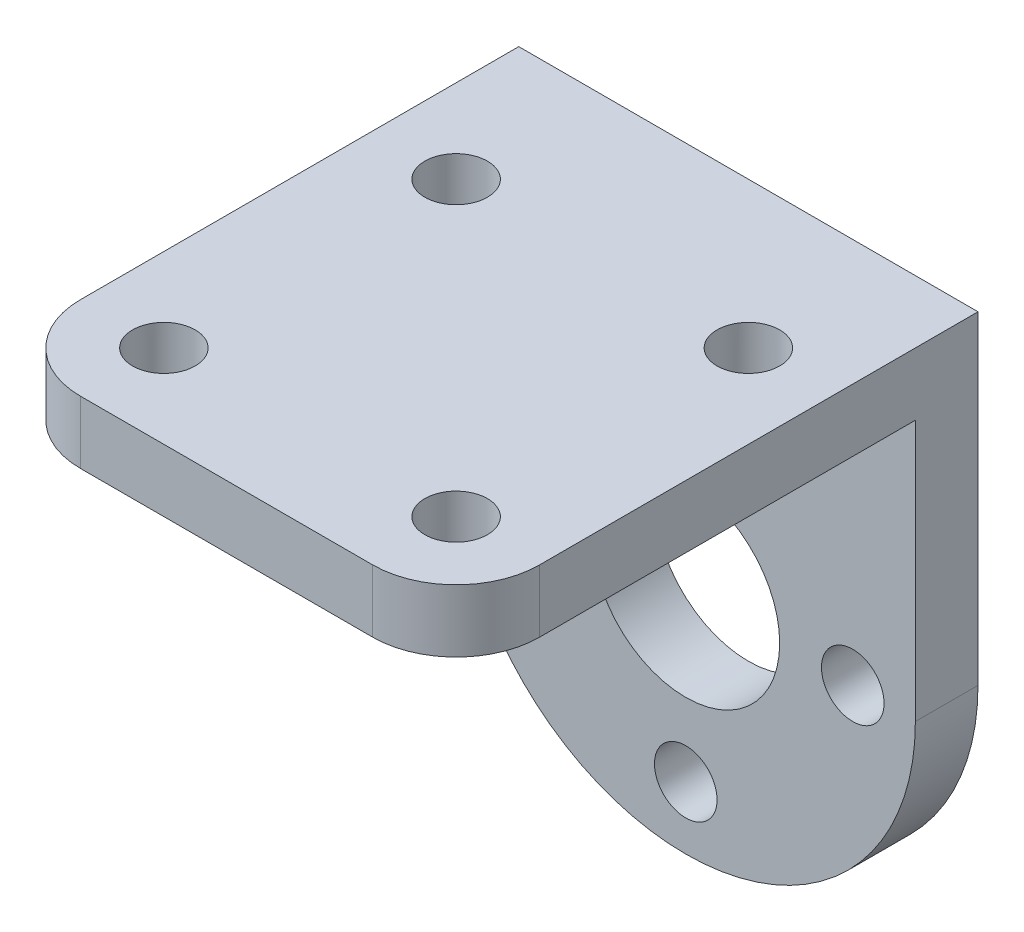
from build123d import *

# Parameters (mm, degrees)
ESQUISSE1_R             = 1.5
ESQUISSE1_R_2           = 4.5
BOSS_EXTRU_1_DEPTH      = 3
ESQUISSE2_W             = 22
ESQUISSE2_H             = 3
BOSS_EXTRU_2_DEPTH      = 22
ENL_V_MAT_EXTRU_1_REACH = 38.031
ESQUISSE3_R             = 1.5
CONG_1_R                = 4


with BuildPart() as part:
    # Esquisse1 → Boss.-Extru.1 (new body)
    with BuildSketch(Plane.XY):
        with BuildLine():
            Line((11, 0), (11, 15.5))
            Line((11, 15.5), (-11, 15.5))
            Line((-11, 15.5), (-11, 0))
            ThreePointArc((-11, 0), (0, -11), (11, 0))
        make_face()
        with Locations((8, 0)):
            Circle(ESQUISSE1_R, mode=Mode.SUBTRACT)
        with Locations((0, -8)):
            Circle(ESQUISSE1_R, mode=Mode.SUBTRACT)
        with Locations((0, 8)):
            Circle(ESQUISSE1_R, mode=Mode.SUBTRACT)
        with Locations((-8, 0)):
            Circle(ESQUISSE1_R, mode=Mode.SUBTRACT)
        Circle(ESQUISSE1_R_2, mode=Mode.SUBTRACT)
    extrude(amount=BOSS_EXTRU_1_DEPTH)

    # Esquisse2 → Boss.-Extru.2 (add)
    with BuildSketch(Plane.XY.offset(3)):
        with Locations((0, 14)):
            Rectangle(ESQUISSE2_W, ESQUISSE2_H)
    extrude(amount=BOSS_EXTRU_2_DEPTH)

    # Esquisse3 → Enlèv. mat.-Extru.1 (cut, up to next)
    with BuildSketch(Plane.XZ.offset(-12.5), mode=Mode.PRIVATE) as enl_v_mat_extru_1_sk1:
        with Locations((7, 21)):
            Circle(ESQUISSE3_R)
    enl_v_mat_extru_1_tool1 = extrude(enl_v_mat_extru_1_sk1.sketch, amount=-ENL_V_MAT_EXTRU_1_REACH, mode=Mode.PRIVATE) & part.part
    # Esquisse3 → Enlèv. mat.-Extru.1 (cut, up to next)
    with BuildSketch(Plane.XZ.offset(-12.5), mode=Mode.PRIVATE) as enl_v_mat_extru_1_sk2:
        with Locations((-7, 21)):
            Circle(ESQUISSE3_R)
    enl_v_mat_extru_1_tool2 = extrude(enl_v_mat_extru_1_sk2.sketch, amount=-ENL_V_MAT_EXTRU_1_REACH, mode=Mode.PRIVATE) & part.part
    # Esquisse3 → Enlèv. mat.-Extru.1 (cut, up to next)
    with BuildSketch(Plane.XZ.offset(-12.5), mode=Mode.PRIVATE) as enl_v_mat_extru_1_sk3:
        with Locations((7, 7)):
            Circle(ESQUISSE3_R)
    enl_v_mat_extru_1_tool3 = extrude(enl_v_mat_extru_1_sk3.sketch, amount=-ENL_V_MAT_EXTRU_1_REACH, mode=Mode.PRIVATE) & part.part
    # Esquisse3 → Enlèv. mat.-Extru.1 (cut, up to next)
    with BuildSketch(Plane.XZ.offset(-12.5), mode=Mode.PRIVATE) as enl_v_mat_extru_1_sk4:
        with Locations((-7, 7)):
            Circle(ESQUISSE3_R)
    enl_v_mat_extru_1_tool4 = extrude(enl_v_mat_extru_1_sk4.sketch, amount=-ENL_V_MAT_EXTRU_1_REACH, mode=Mode.PRIVATE) & part.part
    add(enl_v_mat_extru_1_tool1.solids().sort_by_distance((7, 12.5, 21))[0], mode=Mode.SUBTRACT)
    add(enl_v_mat_extru_1_tool2.solids().sort_by_distance((-7, 12.5, 21))[0], mode=Mode.SUBTRACT)
    add(enl_v_mat_extru_1_tool3.solids().sort_by_distance((7, 12.5, 7))[0], mode=Mode.SUBTRACT)
    add(enl_v_mat_extru_1_tool4.solids().sort_by_distance((-7, 12.5, 7))[0], mode=Mode.SUBTRACT)

    # Congé1
    cong_1_edges = [part.edges().sort_by_distance(p)[0] for p in [
        (11, 14, 25),
        (-11, 14, 25),
    ]]
    fillet(cong_1_edges, radius=CONG_1_R)


solid = part.part
